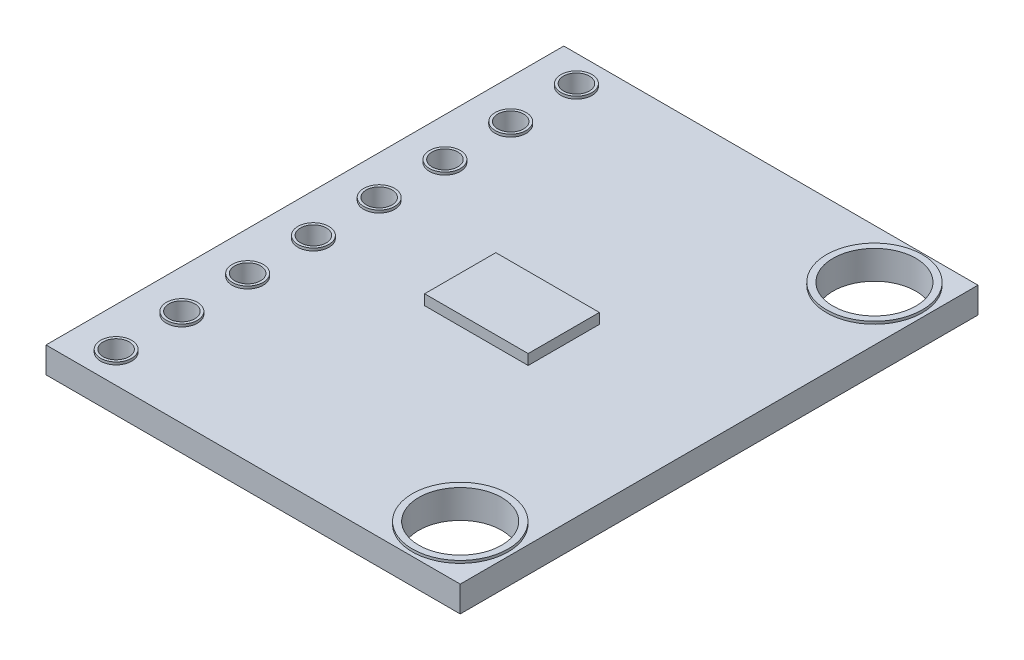
from build123d import *

# Parameters (mm, degrees)
SKETCH1_W                   = 16
SKETCH1_H                   = 20
BOSS_EXTRUDE1_DEPTH         = 1
SKETCH4_W                   = 4
SKETCH4_H                   = 2.75
BOSS_EXTRUDE3_DEPTH         = 0.4
IZIM1_R                     = 0.6
IZIM1_R_2                   = 0.5
Y_KSEKLIK_EKSTR_ZYON1_DEPTH = 0.1
KES_EKSTR_ZYON2_START       = -20.1
IZIM3_R                     = 0.5
KES_EKSTR_ZYON2_DEPTH       = 20.1
IZIM4_R                     = 1.85
IZIM4_R_2                   = 1.6
Y_KSEKLIK_EKSTR_ZYON2_DEPTH = 0.1
KES_EKSTR_ZYON3_START       = -10.1
IZIM5_R                     = 1.6
KES_EKSTR_ZYON3_DEPTH       = 10.1


with BuildPart() as part:
    # Sketch1 → Boss-Extrude1 (new body)
    with BuildSketch(Plane(origin=(0, 0, 0), x_dir=(1, 0, 0), z_dir=(0, 1, 0))):
        Rectangle(SKETCH1_W, SKETCH1_H)
    extrude(amount=BOSS_EXTRUDE1_DEPTH)

    # Çizim1 → Yükseklik-Ekstrüzyon1 (add)
    # profile 1 of 8: a face of its own
    with BuildSketch(Plane(origin=(0, 1, 0), x_dir=(1, 0, 0), z_dir=(0, 1, 0))):
        with Locations(Location((-6.400785843, -8.89, 0), (0, 0, 90))):
            Circle(IZIM1_R)
        with Locations(Location((-6.400785843, -8.89, 0), (0, 0, 270))):
            Circle(IZIM1_R_2, mode=Mode.SUBTRACT)
    # profile 2 of 8: a face of its own
    with BuildSketch(Plane(origin=(0, 1, 0), x_dir=(1, 0, 0), z_dir=(0, 1, 0))):
        with Locations(Location((-6.400785843, -6.35, 0), (0, 0, 90))):
            Circle(IZIM1_R)
        with Locations(Location((-6.400785843, -6.35, 0), (0, 0, 270))):
            Circle(IZIM1_R_2, mode=Mode.SUBTRACT)
    # profile 3 of 8: a face of its own
    with BuildSketch(Plane(origin=(0, 1, 0), x_dir=(1, 0, 0), z_dir=(0, 1, 0))):
        with Locations(Location((-6.400785843, -3.81, 0), (0, 0, 90))):
            Circle(IZIM1_R)
        with Locations(Location((-6.400785843, -3.81, 0), (0, 0, 270))):
            Circle(IZIM1_R_2, mode=Mode.SUBTRACT)
    # profile 4 of 8: a face of its own
    with BuildSketch(Plane(origin=(0, 1, 0), x_dir=(1, 0, 0), z_dir=(0, 1, 0))):
        with Locations(Location((-6.400785843, -1.27, 0), (0, 0, 90))):
            Circle(IZIM1_R)
        with Locations(Location((-6.400785843, -1.27, 0), (0, 0, 270))):
            Circle(IZIM1_R_2, mode=Mode.SUBTRACT)
    # profile 5 of 8: a face of its own
    with BuildSketch(Plane(origin=(0, 1, 0), x_dir=(1, 0, 0), z_dir=(0, 1, 0))):
        with Locations(Location((-6.400785843, 1.27, 0), (0, 0, 90))):
            Circle(IZIM1_R)
        with Locations(Location((-6.400785843, 1.27, 0), (0, 0, 270))):
            Circle(IZIM1_R_2, mode=Mode.SUBTRACT)
    # profile 6 of 8: a face of its own
    with BuildSketch(Plane(origin=(0, 1, 0), x_dir=(1, 0, 0), z_dir=(0, 1, 0))):
        with Locations(Location((-6.400785843, 3.81, 0), (0, 0, 90))):
            Circle(IZIM1_R)
        with Locations(Location((-6.400785843, 3.81, 0), (0, 0, 270))):
            Circle(IZIM1_R_2, mode=Mode.SUBTRACT)
    # profile 7 of 8: a face of its own
    with BuildSketch(Plane(origin=(0, 1, 0), x_dir=(1, 0, 0), z_dir=(0, 1, 0))):
        with Locations(Location((-6.400785843, 6.35, 0), (0, 0, 90))):
            Circle(IZIM1_R)
        with Locations(Location((-6.400785843, 6.35, 0), (0, 0, 270))):
            Circle(IZIM1_R_2, mode=Mode.SUBTRACT)
    # profile 8 of 8: a face of its own
    with BuildSketch(Plane(origin=(0, 1, 0), x_dir=(1, 0, 0), z_dir=(0, 1, 0))):
        with Locations(Location((-6.400785843, 8.89, 0), (0, 0, 90))):
            Circle(IZIM1_R)
        with Locations(Location((-6.400785843, 8.89, 0), (0, 0, 270))):
            Circle(IZIM1_R_2, mode=Mode.SUBTRACT)
    extrude(amount=Y_KSEKLIK_EKSTR_ZYON1_DEPTH)

    # Çizim3 → Kes-Ekstrüzyon2 (cut)
    with BuildSketch(Plane(origin=(0, 1, 0), x_dir=(1, 0, 0), z_dir=(0, 1, 0)).offset(KES_EKSTR_ZYON2_START)):
        with Locations(Location((-6.400785843, -8.89, 0), (0, 0, 90))):
            Circle(IZIM3_R)
        with Locations(Location((-6.400785843, -6.35, 0), (0, 0, 90))):
            Circle(IZIM3_R)
        with Locations(Location((-6.400785843, -3.81, 0), (0, 0, 90))):
            Circle(IZIM3_R)
        with Locations(Location((-6.400785843, -1.27, 0), (0, 0, 90))):
            Circle(IZIM3_R)
        with Locations(Location((-6.400785843, 1.27, 0), (0, 0, 90))):
            Circle(IZIM3_R)
        with Locations(Location((-6.400785843, 3.81, 0), (0, 0, 90))):
            Circle(IZIM3_R)
        with Locations(Location((-6.400785843, 6.35, 0), (0, 0, 90))):
            Circle(IZIM3_R)
        with Locations(Location((-6.400785843, 8.89, 0), (0, 0, 90))):
            Circle(IZIM3_R)
    extrude(amount=KES_EKSTR_ZYON2_DEPTH, mode=Mode.SUBTRACT)

    # Çizim4 → Yükseklik-Ekstrüzyon2 (add)
    # profile 1 of 2: a face of its own
    with BuildSketch(Plane(origin=(0, 1, 0), x_dir=(1, 0, 0), z_dir=(0, 1, 0))):
        with Locations(Location((6, -8, 0), (0, 0, 90))):
            Circle(IZIM4_R)
        with Locations(Location((6, -8, 0), (0, 0, 270))):
            Circle(IZIM4_R_2, mode=Mode.SUBTRACT)
    # profile 2 of 2: a face of its own
    with BuildSketch(Plane(origin=(0, 1, 0), x_dir=(1, 0, 0), z_dir=(0, 1, 0))):
        with Locations(Location((6, 8, 0), (0, 0, 90))):
            Circle(IZIM4_R)
        with Locations(Location((6, 8, 0), (0, 0, 270))):
            Circle(IZIM4_R_2, mode=Mode.SUBTRACT)
    extrude(amount=Y_KSEKLIK_EKSTR_ZYON2_DEPTH)

    # Çizim5 → Kes-Ekstrüzyon3 (cut)
    with BuildSketch(Plane(origin=(0, 1, 0), x_dir=(1, 0, 0), z_dir=(0, 1, 0)).offset(KES_EKSTR_ZYON3_START)):
        with Locations(Location((6, 8, 0), (0, 0, 90))):
            Circle(IZIM5_R)
        with Locations(Location((6, -8, 0), (0, 0, 90))):
            Circle(IZIM5_R)
    extrude(amount=KES_EKSTR_ZYON3_DEPTH, mode=Mode.SUBTRACT)


with BuildPart() as body_2:
    # Sketch4 → Boss-Extrude3 (new body)
    with BuildSketch(Plane(origin=(0, 1, 0), x_dir=(1, 0, 0), z_dir=(0, 1, 0))):
        Rectangle(SKETCH4_W, SKETCH4_H)
    extrude(amount=BOSS_EXTRUDE3_DEPTH)


solid = Compound([part.part, body_2.part])
